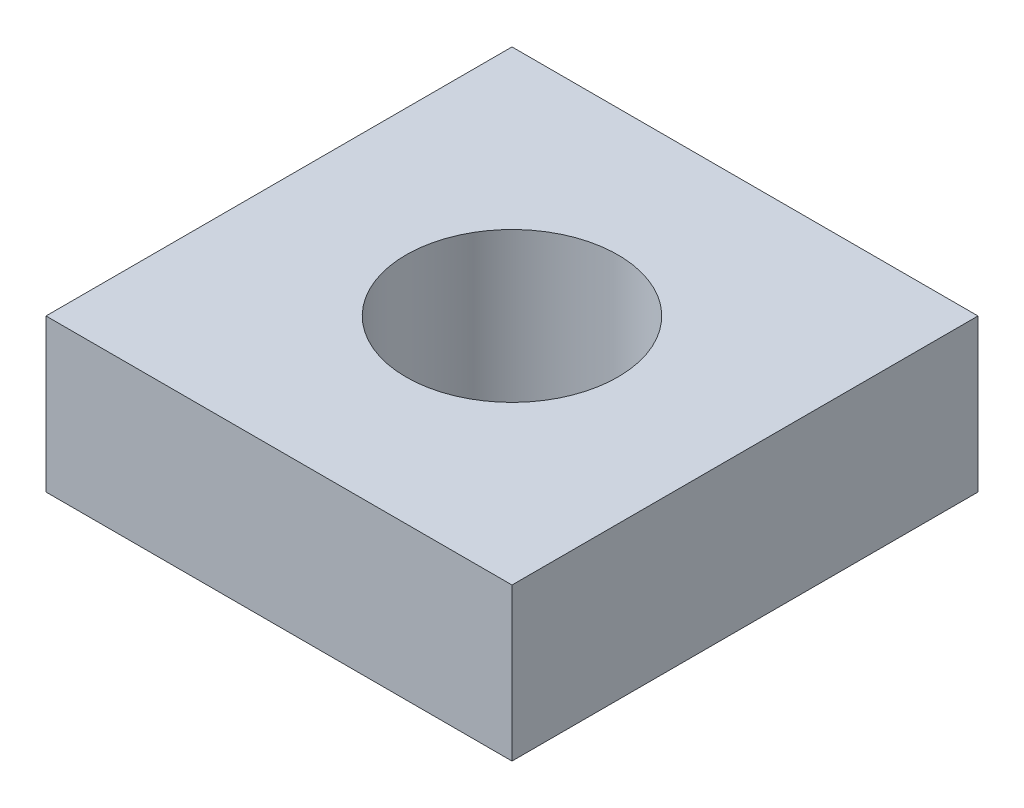
from build123d import *

# Parameters (mm, degrees)
SKETCH1_W             = 5.5
SKETCH1_H             = 5.5
BOSS_EXTRUDE1_DEPTH   = 1.8
M3X0_5_TAPPED_HOLE1_D = 2.5


with BuildPart() as part:
    # Sketch1 → Boss-Extrude1 (new body)
    with BuildSketch(Plane(origin=(0, 0, 0), x_dir=(1, 0, 0), z_dir=(0, 1, 0))):
        Rectangle(SKETCH1_W, SKETCH1_H)
    extrude(amount=BOSS_EXTRUDE1_DEPTH)

    # M3x0.5 Tapped Hole1 (through all)
    with Locations(Plane(origin=(0, 1.8, 0), x_dir=(1, 0, 0), z_dir=(0, 1, 0))):
        with Locations((0, 0)):
            Hole(M3X0_5_TAPPED_HOLE1_D / 2)


solid = part.part
